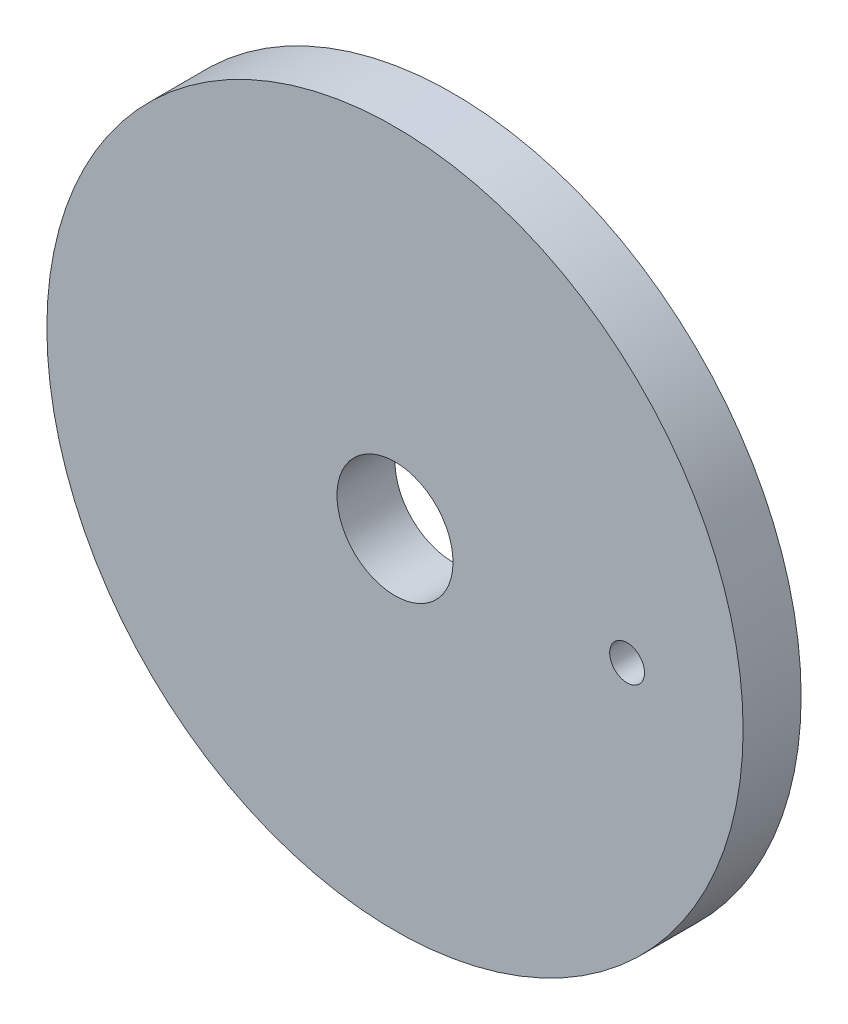
from build123d import *

# Parameters (mm, degrees)
SKETCH1_R         = 76.2
ROUND_PLATE_DEPTH = 12.7
SKETCH2_R         = 12.7
CENTRE_BORE_DEPTH = 109.508847566
SKETCH3_R         = 3.81
SEED_HOLE_DEPTH   = 109.508847566


with BuildPart() as part:
    # Sketch1 → round_plate (new body)
    with BuildSketch(Plane.XY):
        Circle(SKETCH1_R)
    extrude(amount=ROUND_PLATE_DEPTH)

    # Sketch2 → centre_bore (cut, through all)
    with BuildSketch(Plane.XY):
        Circle(SKETCH2_R)
    extrude(amount=CENTRE_BORE_DEPTH, mode=Mode.SUBTRACT)

    # Sketch3 → seed_hole (cut, through all)
    with BuildSketch(Plane.XY):
        with Locations((50.8, 0)):
            Circle(SKETCH3_R)
    extrude(amount=SEED_HOLE_DEPTH, mode=Mode.SUBTRACT)


solid = part.part
